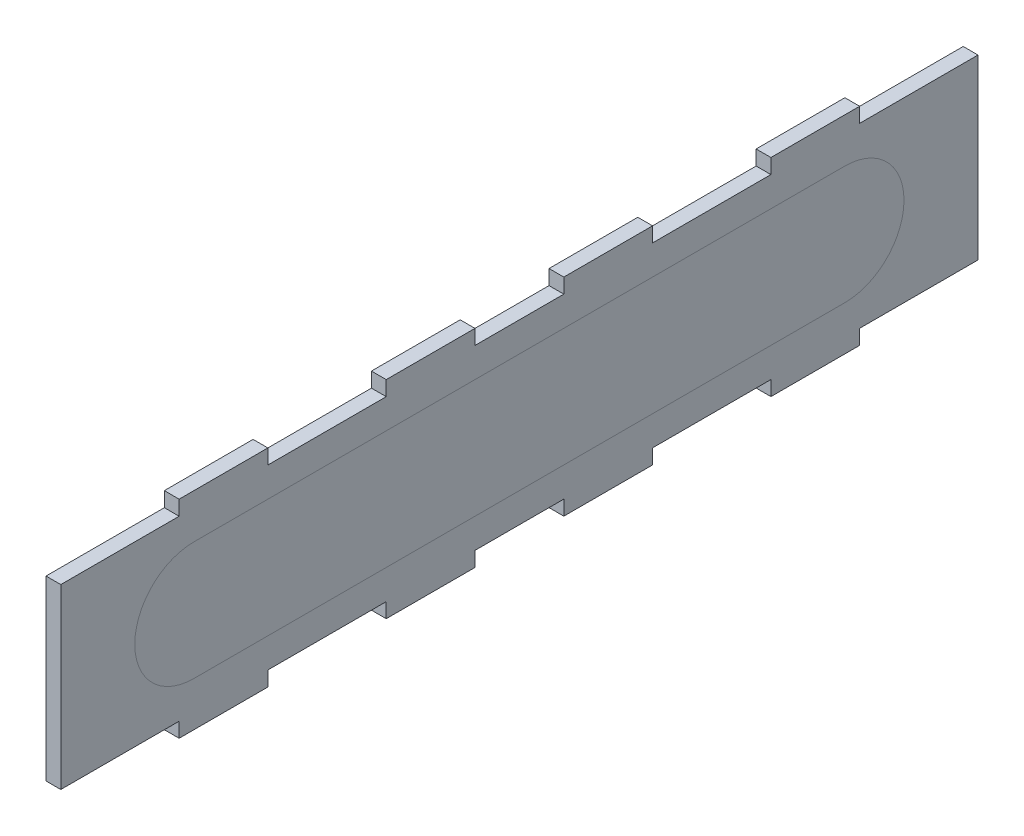
from build123d import *

# Parameters (mm, degrees)
BOSS_EXTRUDE1_DEPTH = 1.25
BOSS_EXTRUDE2_DEPTH = 1.25


with BuildPart() as part:
    # Sketch1 → Boss-Extrude1 (new, symmetric)
    with BuildSketch(Plane(origin=(0, 0, 0), x_dir=(0, 0, -1), z_dir=(1, 0, 0))):
        Polygon((-77.50700933, 15), (-77.50700933, -15), (-57.50700933, -15), (-57.50700933, -17.5), (-42.50700933, -17.5), (-42.50700933, -15), (-22.50700933, -15), (-22.50700933, -17.5), (-7.50700933, -17.5), (-7.50700933, -15), (7.50700933, -15), (7.50700933, -17.5), (22.50700933, -17.5), (22.50700933, -15), (42.50700933, -15), (42.50700933, -17.5), (57.50700933, -17.5), (57.50700933, -15), (77.50700933, -15), (77.50700933, 15), (57.50700933, 15), (57.50700933, 17.5), (42.50700933, 17.5), (42.50700933, 15), (22.50700933, 15), (22.50700933, 17.5), (7.50700933, 17.5), (7.50700933, 15), (-7.50700933, 15), (-7.50700933, 17.5), (-22.50700933, 17.5), (-22.50700933, 15), (-42.50700933, 15), (-42.50700933, 17.5), (-57.50700933, 17.5), (-57.50700933, 15), align=None)
        with BuildLine():
            Line((-55, 10), (55, 10))
            ThreePointArc((55, 10), (65, 0), (55, -10))
            Line((55, -10), (-55, -10))
            ThreePointArc((-55, -10), (-65, 0), (-55, 10))
        make_face(mode=Mode.SUBTRACT)
    extrude(amount=BOSS_EXTRUDE1_DEPTH, both=True)


with BuildPart() as body_2:
    # Sketch1<2> → Boss-Extrude2 (new, symmetric)
    with BuildSketch(Plane(origin=(0, 0, 0), x_dir=(0, 0, -1), z_dir=(1, 0, 0))):
        with BuildLine():
            Line((55, 10), (-55, 10))
            ThreePointArc((-55, 10), (-65, 0), (-55, -10))
            Line((-55, -10), (55, -10))
            ThreePointArc((55, -10), (65, 0), (55, 10))
        make_face()
    extrude(amount=BOSS_EXTRUDE2_DEPTH, both=True)


solid = Compound([part.part, body_2.part])
